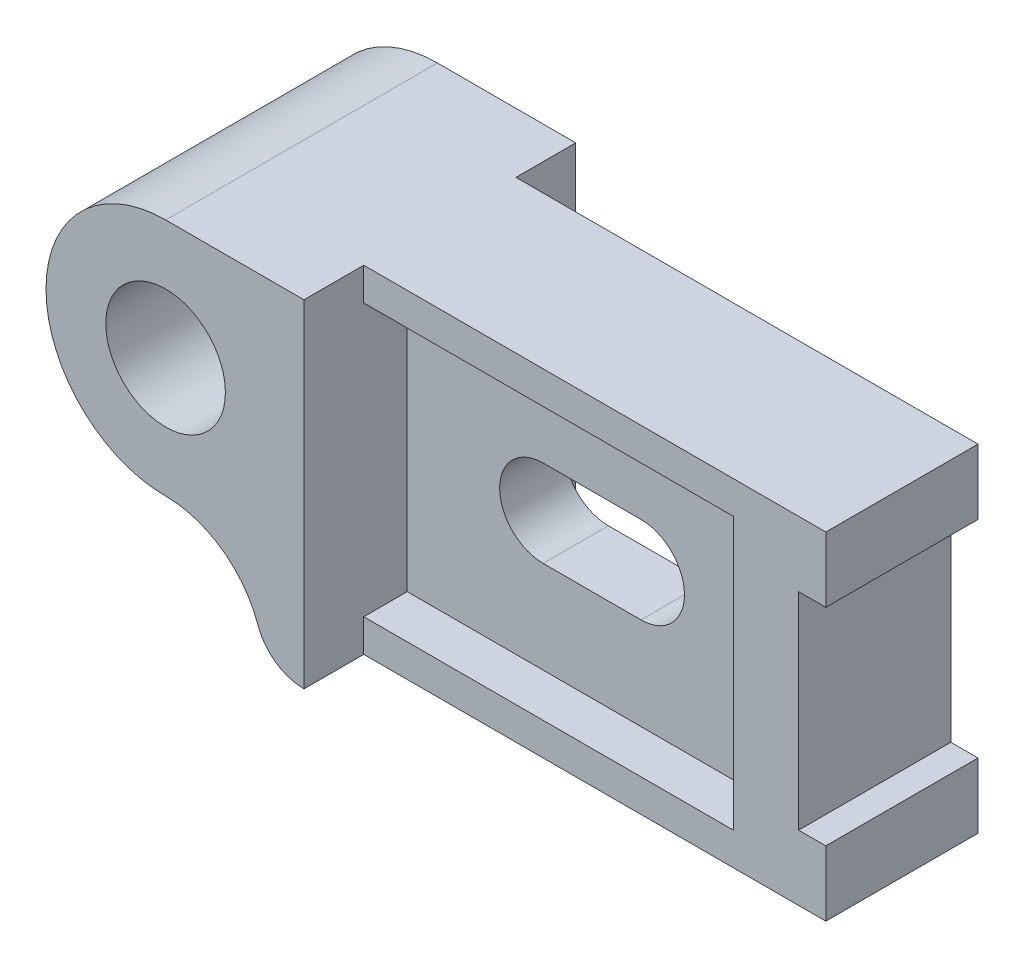
from build123d import *

# Parameters (mm, degrees)
SKETCH1_R           = 11
BOSS_EXTRUDE1_DEPTH = 50
SKETCH2_W           = 28
SKETCH2_H           = 6
BOSS_EXTRUDE2_DEPTH = 68
SKETCH3_W           = 12
SKETCH3_H           = 50
BOSS_EXTRUDE3_DEPTH = 68
SKETCH4_W           = 28
SKETCH4_H           = 62
BOSS_EXTRUDE4_DEPTH = 12
SKETCH5_W           = 28
SKETCH5_H           = 12
BOSS_EXTRUDE5_DEPTH = 5
CUT_EXTRUDE1_DEPTH  = 122.49490099


with BuildPart() as part:
    # Sketch1 → Boss-Extrude1 (new body)
    with BuildSketch(Plane.XY):
        with BuildLine():
            Line((0, 22), (25.453659816, 22))
            Line((25.453659816, 22), (25.453659816, -40))
            ThreePointArc((25.453659816, -40), (20.193625944, -38.302879135), (16.917350568, -33.851565259))
            ThreePointArc((16.917350568, -33.851565259), (10.327830718, -25.257682927), (0, -22))
            ThreePointArc((0, -22), (-22, 0), (0, 22))
        make_face()
        Circle(SKETCH1_R, mode=Mode.SUBTRACT)
    extrude(amount=-BOSS_EXTRUDE1_DEPTH)

    # Sketch2 → Boss-Extrude2 (add)
    with BuildSketch(Plane(origin=(25.453659816, 0, 0), x_dir=(0, 0, -1), z_dir=(1, 0, 0))):
        with Locations((25, 19)):
            Rectangle(SKETCH2_W, SKETCH2_H)
        with Locations((25, -37)):
            Rectangle(SKETCH2_W, SKETCH2_H)
    extrude(amount=BOSS_EXTRUDE2_DEPTH)

    # Sketch3 → Boss-Extrude3 (add)
    with BuildSketch(Plane(origin=(25.453659816, 0, 0), x_dir=(0, 0, -1), z_dir=(1, 0, 0))):
        with Locations((25, -9)):
            Rectangle(SKETCH3_W, SKETCH3_H)
    extrude(amount=BOSS_EXTRUDE3_DEPTH)

    # Sketch4 → Boss-Extrude4 (add)
    with BuildSketch(Plane(origin=(93.453659816, 0, 0), x_dir=(0, 0, -1), z_dir=(1, 0, 0))):
        with Locations((25, -9)):
            Rectangle(SKETCH4_W, SKETCH4_H)
    extrude(amount=BOSS_EXTRUDE4_DEPTH)

    # Sketch5 → Boss-Extrude5 (add)
    with BuildSketch(Plane(origin=(105.453659816, 0, 0), x_dir=(0, 0, -1), z_dir=(1, 0, 0))):
        with Locations((25, 16)):
            Rectangle(SKETCH5_W, SKETCH5_H)
        with Locations((25, -34)):
            Rectangle(SKETCH5_W, SKETCH5_H)
    extrude(amount=BOSS_EXTRUDE5_DEPTH)

    # Sketch8 → Cut-Extrude1 (cut, through all)
    with BuildSketch(Plane.XY.offset(-19)):
        with BuildLine():
            Line((50.453659816, -1), (68.453659816, -1))
            ThreePointArc((68.453659816, -1), (76.453659816, -9), (68.453659816, -17))
            Line((68.453659816, -17), (50.453659816, -17))
            ThreePointArc((50.453659816, -17), (42.453659816, -9), (50.453659816, -1))
        make_face()
    extrude(amount=-CUT_EXTRUDE1_DEPTH, mode=Mode.SUBTRACT)


solid = part.part
